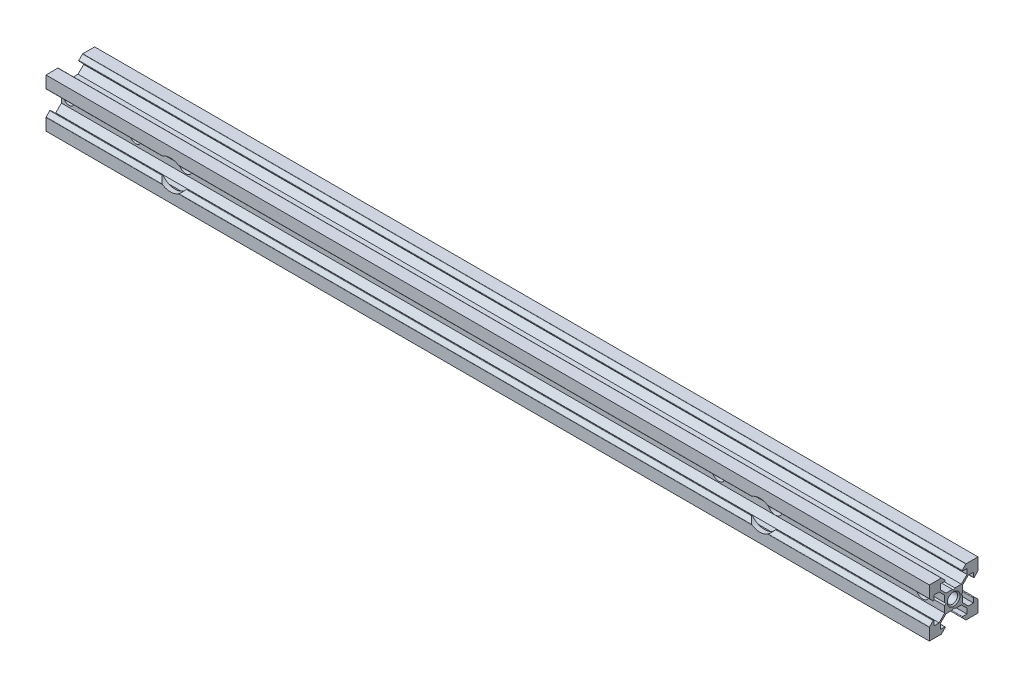
from build123d import *

# Parameters (mm, degrees)
MAIN_BODY_DEPTH            = 172.5
MAIN_BODY_DEPTH_BACK       = 172.5
SKETCH2_R                  = 2
CHAMFER1_SIZE              = 0.5
CHAMFER2_SIZE              = 0.5
BASE_FIX_REACH             = 175.022
SKETCH4_W                  = 1
SKETCH4_H                  = 0.528792541
SKETCH4_W_2                = 0.528792541
SKETCH4_H_2                = 1
BASE_FIX_DIRECTION_2_REACH = 175.022
SCREW_HOLES_DEPTH          = 174.02230664
SCREW_HOLES_DEPTH_BACK     = 174.02230664
SKETCH3_R                  = 2.55
SKETCH3_R_2                = 2.95
SKETCH3_R_3                = 2.25
SKETCH3_R_4                = 2.6
RAIL_CUT_DEPTH             = 346.261449622
CUT_EXTRUDE19_REACH        = 175.803
SKETCH11_R                 = 5.75


with BuildPart() as part:
    # Sketch2 → Main Body (new, two sides: drawn at the far end of the back side and taken through both)
    with BuildSketch(Plane(origin=(0, 0, 0), x_dir=(0, 0, -1), z_dir=(1, 0, 0)).offset(-MAIN_BODY_DEPTH_BACK)):
        with BuildLine():
            Line((0, 3), (-0.5, 3.5))
            Line((-0.5, 3.5), (-3.01, 3.5))
            Line((-3.01, 3.5), (-5.209102089, 5.699102089))
            Line((-5.209102089, 5.699102089), (-5.209102089, 7.699102089))
            Line((-5.209102089, 7.699102089), (-3.479102089, 7.699102089))
            ThreePointArc((-3.479102089, 7.699102089), (-3.294326183, 7.822565403), (-3.337680733, 8.040523446))
            Line((-3.337680733, 8.040523446), (-4.73775216, 9.440594872))
            ThreePointArc((-4.73775216, 9.440594872), (-4.80263683, 9.483949423), (-4.879173516, 9.499173516))
            Line((-4.879173516, 9.499173516), (-9.499173516, 9.499173516))
            Line((-9.499173516, 9.499173516), (-9.499173516, 4.879173516))
            ThreePointArc((-9.499173516, 4.879173516), (-9.483949423, 4.80263683), (-9.440594872, 4.73775216))
            Line((-9.440594872, 4.73775216), (-8.040523446, 3.337680733))
            ThreePointArc((-8.040523446, 3.337680733), (-7.822565403, 3.294326183), (-7.699102089, 3.479102089))
            Line((-7.699102089, 3.479102089), (-7.699102089, 5.209102089))
            Line((-7.699102089, 5.209102089), (-5.699102089, 5.209102089))
            Line((-5.699102089, 5.209102089), (-3.5, 3.01))
            Line((-3.5, 3.01), (-3.5, 0.5))
            Line((-3.5, 0.5), (-3, 0))
            Line((-3, 0), (-3.5, -0.5))
            Line((-3.5, -0.5), (-3.5, -3.01))
            Line((-3.5, -3.01), (-5.699102089, -5.209102089))
            Line((-5.699102089, -5.209102089), (-7.699102089, -5.209102089))
            Line((-7.699102089, -5.209102089), (-7.699102089, -3.479102089))
            ThreePointArc((-7.699102089, -3.479102089), (-7.822565403, -3.294326183), (-8.040523446, -3.337680733))
            Line((-8.040523446, -3.337680733), (-9.440594872, -4.73775216))
            ThreePointArc((-9.440594872, -4.73775216), (-9.483949423, -4.80263683), (-9.499173516, -4.879173516))
            Line((-9.499173516, -4.879173516), (-9.499173516, -9.499173516))
            Line((-9.499173516, -9.499173516), (-4.879173516, -9.499173516))
            ThreePointArc((-4.879173516, -9.499173516), (-4.80263683, -9.483949423), (-4.73775216, -9.440594872))
            Line((-4.73775216, -9.440594872), (-3.337680733, -8.040523446))
            ThreePointArc((-3.337680733, -8.040523446), (-3.294326183, -7.822565403), (-3.479102089, -7.699102089))
            Line((-3.479102089, -7.699102089), (-5.209102089, -7.699102089))
            Line((-5.209102089, -7.699102089), (-5.209102089, -5.699102089))
            Line((-5.209102089, -5.699102089), (-3.01, -3.5))
            Line((-3.01, -3.5), (-0.5, -3.5))
            Line((-0.5, -3.5), (0, -3))
            Line((0, -3), (0.5, -3.5))
            Line((0.5, -3.5), (3.01, -3.5))
            Line((3.01, -3.5), (5.209102089, -5.699102089))
            Line((5.209102089, -5.699102089), (5.209102089, -7.699102089))
            Line((5.209102089, -7.699102089), (3.479102089, -7.699102089))
            ThreePointArc((3.479102089, -7.699102089), (3.294326183, -7.822565403), (3.337680733, -8.040523446))
            Line((3.337680733, -8.040523446), (4.73775216, -9.440594872))
            ThreePointArc((4.73775216, -9.440594872), (4.80263683, -9.483949423), (4.879173516, -9.499173516))
            Line((4.879173516, -9.499173516), (9.499173516, -9.499173516))
            Line((9.499173516, -9.499173516), (9.499173516, -4.879173516))
            ThreePointArc((9.499173516, -4.879173516), (9.483949423, -4.80263683), (9.440594872, -4.73775216))
            Line((9.440594872, -4.73775216), (8.040523446, -3.337680733))
            ThreePointArc((8.040523446, -3.337680733), (7.822565403, -3.294326183), (7.699102089, -3.479102089))
            Line((7.699102089, -3.479102089), (7.699102089, -5.209102089))
            Line((7.699102089, -5.209102089), (5.699102089, -5.209102089))
            Line((5.699102089, -5.209102089), (3.5, -3.01))
            Line((3.5, -3.01), (3.5, -0.5))
            Line((3.5, -0.5), (3, 0))
            Line((3, 0), (3.5, 0.5))
            Line((3.5, 0.5), (3.5, 3.01))
            Line((3.5, 3.01), (5.699102089, 5.209102089))
            Line((5.699102089, 5.209102089), (7.699102089, 5.209102089))
            Line((7.699102089, 5.209102089), (7.699102089, 3.479102089))
            ThreePointArc((7.699102089, 3.479102089), (7.822565403, 3.294326183), (8.040523446, 3.337680733))
            Line((8.040523446, 3.337680733), (9.440594872, 4.73775216))
            ThreePointArc((9.440594872, 4.73775216), (9.483949423, 4.80263683), (9.499173516, 4.879173516))
            Line((9.499173516, 4.879173516), (9.499173516, 9.499173516))
            Line((9.499173516, 9.499173516), (4.879173516, 9.499173516))
            ThreePointArc((4.879173516, 9.499173516), (4.80263683, 9.483949423), (4.73775216, 9.440594872))
            Line((4.73775216, 9.440594872), (3.337680733, 8.040523446))
            ThreePointArc((3.337680733, 8.040523446), (3.294326183, 7.822565403), (3.479102089, 7.699102089))
            Line((3.479102089, 7.699102089), (5.209102089, 7.699102089))
            Line((5.209102089, 7.699102089), (5.209102089, 5.699102089))
            Line((5.209102089, 5.699102089), (3.01, 3.5))
            Line((3.01, 3.5), (0.5, 3.5))
            Line((0.5, 3.5), (0, 3))
        make_face()
        Circle(SKETCH2_R, mode=Mode.SUBTRACT)
    extrude(amount=MAIN_BODY_DEPTH + MAIN_BODY_DEPTH_BACK)

    # Chamfer1
    chamfer1_edges = [part.edges().sort_by_distance(p)[0] for p in [
        (172.5, 0, 2),
    ]]
    chamfer(chamfer1_edges, length=CHAMFER1_SIZE)

    # Chamfer2
    chamfer2_edges = [part.edges().sort_by_distance(p)[0] for p in [
        (-172.5, 0, 2),
    ]]
    chamfer(chamfer2_edges, length=CHAMFER2_SIZE)

    # Base Fix: up to this face of the body (flat: up to its plane)
    base_fix_end = Plane(part.part.faces().sort_by_distance((172.5, 0, 2.7686772))[0])
    # Sketch4 → Base Fix (add, up to the picked face)
    with BuildSketch(Plane(origin=(0, 0, 0), x_dir=(0, 0, -1), z_dir=(1, 0, 0)), mode=Mode.PRIVATE) as base_fix_sk1:
        with Locations((0, 3.23560373)):
            Rectangle(SKETCH4_W, SKETCH4_H)
    base_fix_tool1 = split(extrude(base_fix_sk1.sketch, amount=BASE_FIX_REACH, mode=Mode.PRIVATE), bisect_by=base_fix_end, keep=Keep.BOTH, mode=Mode.PRIVATE)
    # Sketch4 → Base Fix (add, up to the picked face)
    with BuildSketch(Plane(origin=(0, 0, 0), x_dir=(0, 0, -1), z_dir=(1, 0, 0)), mode=Mode.PRIVATE) as base_fix_sk2:
        with Locations((3.23560373, 0)):
            Rectangle(SKETCH4_W_2, SKETCH4_H_2)
    base_fix_tool2 = split(extrude(base_fix_sk2.sketch, amount=BASE_FIX_REACH, mode=Mode.PRIVATE), bisect_by=base_fix_end, keep=Keep.BOTH, mode=Mode.PRIVATE)
    # Sketch4 → Base Fix (add, up to the picked face)
    with BuildSketch(Plane(origin=(0, 0, 0), x_dir=(0, 0, -1), z_dir=(1, 0, 0)), mode=Mode.PRIVATE) as base_fix_sk3:
        with Locations((0, -3.23560373)):
            Rectangle(SKETCH4_W, SKETCH4_H)
    base_fix_tool3 = split(extrude(base_fix_sk3.sketch, amount=BASE_FIX_REACH, mode=Mode.PRIVATE), bisect_by=base_fix_end, keep=Keep.BOTH, mode=Mode.PRIVATE)
    # Sketch4 → Base Fix (add, up to the picked face)
    with BuildSketch(Plane(origin=(0, 0, 0), x_dir=(0, 0, -1), z_dir=(1, 0, 0)), mode=Mode.PRIVATE) as base_fix_sk4:
        with Locations((-3.23560373, 0)):
            Rectangle(SKETCH4_W_2, SKETCH4_H_2)
    base_fix_tool4 = split(extrude(base_fix_sk4.sketch, amount=BASE_FIX_REACH, mode=Mode.PRIVATE), bisect_by=base_fix_end, keep=Keep.BOTH, mode=Mode.PRIVATE)
    add(base_fix_tool1.solids().sort_by(Axis((0, 3.235604, 0), (1, 0, 0)))[0])
    add(base_fix_tool2.solids().sort_by(Axis((0, 0, -3.235604), (1, 0, 0)))[0])
    add(base_fix_tool3.solids().sort_by(Axis((0, -3.235604, 0), (1, 0, 0)))[0])
    add(base_fix_tool4.solids().sort_by(Axis((0, 0, 3.235604), (1, 0, 0)))[0])

    # Base Fix direction 2: up to this face of the body (flat: up to its plane)
    base_fix_direction_2_end = Plane(part.part.faces().sort_by_distance((-172.5, 0, 2.7686772))[0])
    # Sketch4 → Base Fix direction 2 (add, up to the picked face)
    with BuildSketch(Plane(origin=(0, 0, 0), x_dir=(0, 0, -1), z_dir=(1, 0, 0)), mode=Mode.PRIVATE) as base_fix_direction_2_sk1:
        with Locations((0, 3.23560373)):
            Rectangle(SKETCH4_W, SKETCH4_H)
    base_fix_direction_2_tool1 = split(extrude(base_fix_direction_2_sk1.sketch, amount=-BASE_FIX_DIRECTION_2_REACH, mode=Mode.PRIVATE), bisect_by=base_fix_direction_2_end, keep=Keep.BOTH, mode=Mode.PRIVATE)
    # Sketch4 → Base Fix direction 2 (add, up to the picked face)
    with BuildSketch(Plane(origin=(0, 0, 0), x_dir=(0, 0, -1), z_dir=(1, 0, 0)), mode=Mode.PRIVATE) as base_fix_direction_2_sk2:
        with Locations((3.23560373, 0)):
            Rectangle(SKETCH4_W_2, SKETCH4_H_2)
    base_fix_direction_2_tool2 = split(extrude(base_fix_direction_2_sk2.sketch, amount=-BASE_FIX_DIRECTION_2_REACH, mode=Mode.PRIVATE), bisect_by=base_fix_direction_2_end, keep=Keep.BOTH, mode=Mode.PRIVATE)
    # Sketch4 → Base Fix direction 2 (add, up to the picked face)
    with BuildSketch(Plane(origin=(0, 0, 0), x_dir=(0, 0, -1), z_dir=(1, 0, 0)), mode=Mode.PRIVATE) as base_fix_direction_2_sk3:
        with Locations((0, -3.23560373)):
            Rectangle(SKETCH4_W, SKETCH4_H)
    base_fix_direction_2_tool3 = split(extrude(base_fix_direction_2_sk3.sketch, amount=-BASE_FIX_DIRECTION_2_REACH, mode=Mode.PRIVATE), bisect_by=base_fix_direction_2_end, keep=Keep.BOTH, mode=Mode.PRIVATE)
    # Sketch4 → Base Fix direction 2 (add, up to the picked face)
    with BuildSketch(Plane(origin=(0, 0, 0), x_dir=(0, 0, -1), z_dir=(1, 0, 0)), mode=Mode.PRIVATE) as base_fix_direction_2_sk4:
        with Locations((-3.23560373, 0)):
            Rectangle(SKETCH4_W_2, SKETCH4_H_2)
    base_fix_direction_2_tool4 = split(extrude(base_fix_direction_2_sk4.sketch, amount=-BASE_FIX_DIRECTION_2_REACH, mode=Mode.PRIVATE), bisect_by=base_fix_direction_2_end, keep=Keep.BOTH, mode=Mode.PRIVATE)
    add(base_fix_direction_2_tool1.solids().sort_by(Axis((0, 3.235604, 0), (-1, 0, 0)))[0])
    add(base_fix_direction_2_tool2.solids().sort_by(Axis((0, 0, -3.235604), (-1, 0, 0)))[0])
    add(base_fix_direction_2_tool3.solids().sort_by(Axis((0, -3.235604, 0), (-1, 0, 0)))[0])
    add(base_fix_direction_2_tool4.solids().sort_by(Axis((0, 0, 3.235604), (-1, 0, 0)))[0])

    # Sketch3 → Screw Holes (cut, two sides: drawn at the far end of the back side and taken through both)
    with BuildSketch(Plane.XY.offset(-SCREW_HOLES_DEPTH_BACK)):
        with Locations(Location((163.9, 0, 0), (0, 0, 270))):
            Circle(SKETCH3_R)
        with Locations(Location((106.3, 0, 0), (0, 0, 270))):
            Circle(SKETCH3_R_2)
        with Locations(Location((84.2, 0, 0), (0, 0, 270))):
            Circle(SKETCH3_R)
        with Locations(Location((-169.5, 0, 0), (0, 0, 270))):
            Circle(SKETCH3_R_3)
        with Locations(Location((-143.5, 0, 0), (0, 0, 270))):
            Circle(SKETCH3_R_3)
        with Locations(Location((-123.9, 0, 0), (0, 0, 270))):
            Circle(SKETCH3_R_4)
    extrude(amount=SCREW_HOLES_DEPTH + SCREW_HOLES_DEPTH_BACK, mode=Mode.SUBTRACT)

    # Sketch8 → Rail Cut (cut, through all)
    with BuildSketch(Plane(origin=(172.5, 0, 0), x_dir=(0, 0, -1), z_dir=(1, 0, 0))):
        Polygon((-3, 0), (-3.5, -0.5), (-3.5, 0.5), align=None)
        Polygon((0, -3), (0.5, -3.5), (-0.5, -3.5), align=None)
        Polygon((0, 3), (0.5, 3.5), (-0.5, 3.5), align=None)
        Polygon((3.5, 0.5), (3.5, -0.5), (3, 0), align=None)
    extrude(amount=-RAIL_CUT_DEPTH, mode=Mode.SUBTRACT)

    # Cut-Extrude19: up to this face of the body (flat: up to its plane)
    cut_extrude19_end = Plane(part.part.faces().sort_by_distance((0, 4.344102089, 7.699102089))[0])
    # Sketch11 → Cut-Extrude19 (cut, up to the picked face)
    with BuildSketch(Plane.XY.offset(9.499173516), mode=Mode.PRIVATE) as cut_extrude19_sk1:
        with Locations((106.3, 0)):
            Circle(SKETCH11_R)
    cut_extrude19_tool1 = split(extrude(cut_extrude19_sk1.sketch, amount=-CUT_EXTRUDE19_REACH, mode=Mode.PRIVATE), bisect_by=cut_extrude19_end, keep=Keep.BOTH, mode=Mode.PRIVATE)
    # Sketch11 → Cut-Extrude19 (cut, up to the picked face)
    with BuildSketch(Plane.XY.offset(9.499173516), mode=Mode.PRIVATE) as cut_extrude19_sk2:
        with Locations((-123.9, 0)):
            Circle(SKETCH11_R)
    cut_extrude19_tool2 = split(extrude(cut_extrude19_sk2.sketch, amount=-CUT_EXTRUDE19_REACH, mode=Mode.PRIVATE), bisect_by=cut_extrude19_end, keep=Keep.BOTH, mode=Mode.PRIVATE)
    add(cut_extrude19_tool1.solids().sort_by(Axis((106.3, 0, 9.499174), (0, 0, -1)))[0], mode=Mode.SUBTRACT)
    add(cut_extrude19_tool2.solids().sort_by(Axis((-123.9, 0, 9.499174), (0, 0, -1)))[0], mode=Mode.SUBTRACT)


solid = part.part
